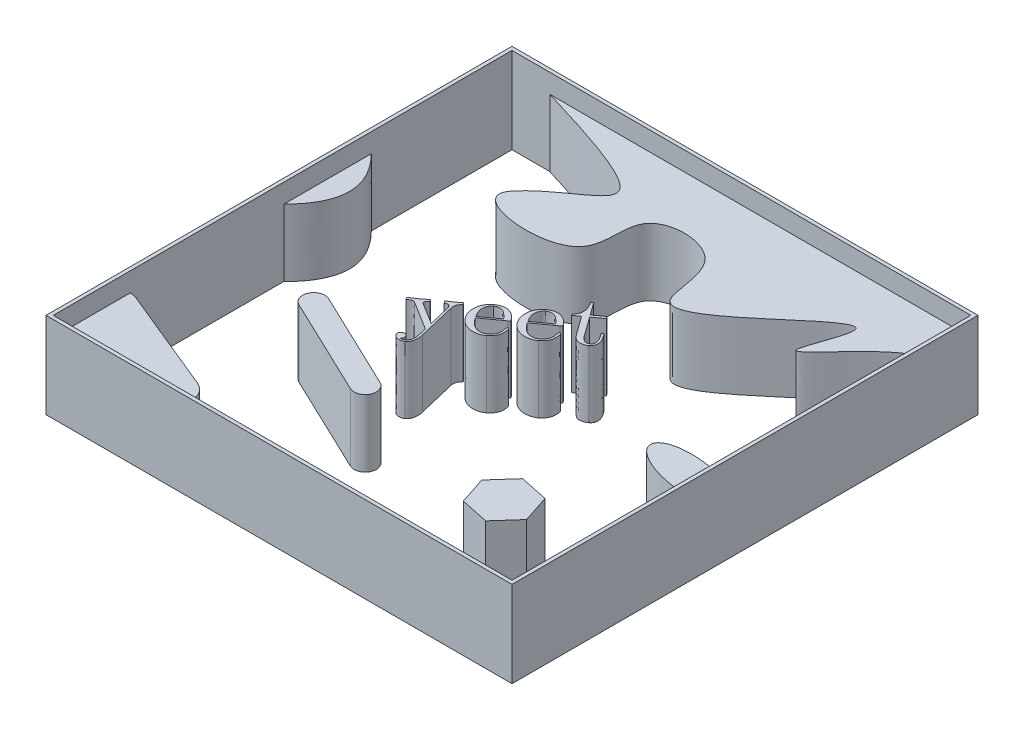
from build123d import *

# Parameters (mm, degrees)
SKETCH1_W                = 4953
SKETCH1_H                = 4953
SKETCH1_W_2              = 4876.8
SKETCH1_H_2              = 4876.8
BOSS_EXTRUDE1_DEPTH      = 914.4
BOSS_EXTRUDE2_DEPTH      = 711.2
BOSS_EXTRUDE2_DEPTH_BACK = 2.54
BOSS_EXTRUDE3_DEPTH      = 711.2
BOSS_EXTRUDE3_2_DEPTH    = 711.2
BOSS_EXTRUDE3_3_DEPTH    = 711.2
BOSS_EXTRUDE3_4_DEPTH    = 711.2
BOSS_EXTRUDE3_5_DEPTH    = 711.2


with BuildPart() as part:
    # Sketch1 → Boss-Extrude1 (new body)
    with BuildSketch(Plane(origin=(0, 0, 0), x_dir=(1, 0, 0), z_dir=(0, 1, 0))):
        Rectangle(SKETCH1_W, SKETCH1_H)
        Rectangle(SKETCH1_W_2, SKETCH1_H_2, mode=Mode.SUBTRACT)
    extrude(amount=BOSS_EXTRUDE1_DEPTH)

    # Sketch3 → Boss-Extrude2 (add, two sides: drawn at the far end of the back side and taken through both)
    with BuildSketch(Plane(origin=(0, 0, 0), x_dir=(1, 0, 0), z_dir=(0, 1, 0)).offset(-BOSS_EXTRUDE2_DEPTH_BACK)):
        with BuildLine():
            Line((-1331.522297366, -617.676058212), (-286.00507187, -1116.307350372))
            ThreePointArc((-286.00507187, -1116.307350372), (-230.167026806, -1273.967712905), (-387.82738934, -1329.805757969))
            Line((-387.82738934, -1329.805757969), (-1433.344614835, -831.17446581))
            ThreePointArc((-1433.344614835, -831.17446581), (-1489.182659899, -673.514103276), (-1331.522297366, -617.676058212))
        make_face()
        Polygon((1754.118220386, -1598.910920974), (1657.974140902, -1306.780680861), (1356.909892009, -1243.978776061), (1151.989722599, -1473.307111374), (1248.133802083, -1765.437351488), (1549.198050977, -1828.239256288), align=None)
        with BuildLine():
            Line((-2359.063833134, -1635.567425286), (-1252.1861305, -2091.344658835))
            ThreePointArc((-1252.1861305, -2091.344658835), (-1126.26137926, -2248.174931097), (-1191.585191407, -2438.4))
            Line((-1191.585191407, -2438.4), (-2438.4, -2438.4))
            Line((-2438.4, -2438.4), (-2438.4, -1619.872603883))
            ThreePointArc((-2438.4, -1619.872603883), (-2397.96315173, -1623.833964926), (-2359.063833134, -1635.567425286))
        make_face()
        with BuildLine():
            Line((-2438.4, 942.892603244), (-2438.4, 15.629799755))
            add(Edge.make_bspline(
                [(-2438.4, 942.892603244), (-1974.768598255, 479.2612015), (-2438.4, 15.629799755)],
                knots=[0, 0, 0, 1, 1, 1], degree=2))
        make_face()
        with BuildLine():
            Line((2438.4, 2438.4), (-2033.871111986, 2438.4))
            add(Edge.make_bspline(
                [(-2033.871111986, 2438.4), (-132.861045574, 1869.482226034), (-884.038824291, 1875.122459824), (-1598.144735508, 1067.86566456), (-185.869349394, 912.310001756), (-553.061712466, 1926.60510057), (493.217755425, 1908.913729189), (381.782702475, 899.461252853), (1122.889740167, 1447.820059883), (1961.417076987, 2223.653405623), (1328.255761502, 822.275024129), (2273.472620936, 2188.760131111), (2438.4, 1945.664883101)],
                knots=[0, 0, 0, 0, 0.232883367, 0.254080977, 0.374413592, 0.45076178, 0.536670962, 0.613758599, 0.711876288, 0.803327454, 0.869142534, 1, 1, 1, 1], degree=3))
            Line((2438.4, 1945.664883101), (2438.4, 2438.4))
        make_face()
    extrude(amount=BOSS_EXTRUDE2_DEPTH + BOSS_EXTRUDE2_DEPTH_BACK)


with BuildPart() as boss_extrude2_piece_1:
    # of the separate pieces the step leaves, piece 1, a body of its own (boss_extrude2_pieces)
    add(part.part.solids().sort_by_distance((-2476.5, 0, -2476.5))[0])


with BuildPart() as boss_extrude2_piece_2:
    # of the separate pieces the step leaves, piece 2, a body of its own (boss_extrude2_pieces)
    add(part.part.solids().sort_by_distance((-1433.344614835, 711.2, 831.17446581))[0])


with BuildPart() as boss_extrude2_piece_3:
    # of the separate pieces the step leaves, piece 3, a body of its own (boss_extrude2_pieces)
    add(part.part.solids().sort_by_distance((1754.118220386, 711.2, 1598.910920974))[0])


with BuildPart() as body_4:
    # Sketch5 → Boss-Extrude3 (new body)
    with BuildSketch(Plane(origin=(0, 0, 0), x_dir=(1, 0, 0), z_dir=(0, 1, 0))):
        with BuildLine():
            Line((2438.4, -191.102014594), (2438.4, -523.608637604))
            add(Edge.make_bspline(
                [(2438.4, -191.102014594), (1721.151111287, 69.064652132), (1721.151111287, -248.304260924), (1721.151111287, -565.67317398), (2438.4, -523.608637604)],
                knots=[1.141976661, 1.141976661, 1.141976661, 3.209045731, 3.209045731, 5.276114801, 5.276114801, 5.276114801], degree=2, weights=[1, 0.511785482, 1, 0.511785482, 1]))
        make_face()
    extrude(amount=BOSS_EXTRUDE3_DEPTH)


with BuildPart() as body_5:
    # Sketch5 → Boss-Extrude3 2 (new body)
    with BuildSketch(Plane(origin=(0, 0, 0), x_dir=(1, 0, 0), z_dir=(0, 1, 0))):
        with BuildLine():
            add(Edge.make_bspline(
                [(-640.160530282, -592.946270319), (-636.955082938, -596.760988355), (-630.699575198, -604.20550253), (-618.643704483, -612.437628467), (-605.257333451, -618.164979196), (-590.549498936, -620.691926764), (-575.362260503, -620.718373242), (-560.193430525, -617.973132453), (-545.316548657, -612.341590669), (-536.238153008, -606.591392069), (-531.558408985, -603.627271693)],
                knots=[0, 0, 0, 0, 0.98538293, 1.922998534, 2.867734393, 3.857062486, 4.864159226, 5.870279062, 6.902168487, 8, 8, 8, 8], degree=3))
            add(Edge.make_bspline(
                [(-531.558408985, -603.627271693), (-528.888465841, -601.446054188), (-523.627239335, -597.147880504), (-516.684507814, -589.873787656), (-510.565421828, -582.189928064), (-505.202145206, -574.099623383), (-501.006161877, -565.368240614), (-497.491901759, -556.279125085), (-494.716376313, -546.763774368), (-492.657315393, -533.384549762), (-491.213109892, -516.370075564), (-491.733381762, -495.745753613), (-493.755592028, -474.988523413), (-496.855820807, -461.344762206), (-498.422361531, -454.450591134)],
                knots=[0, 0, 0, 0, 0.765164453, 1.507786229, 2.227855625, 2.945389557, 3.658336933, 4.374536154, 5.108828506, 5.854267196, 7.377134679, 8.895207604, 10.431153287, 12, 12, 12, 12], degree=3))
            Line((-498.422361531, -454.450591134), (-593.736218663, -54.170215191))
            add(Edge.make_bspline(
                [(-593.736218663, -54.170215191), (-594.390379488, -50.634539472), (-595.649518705, -43.829014316), (-596.458542526, -33.841273127), (-596.860641962, -24.532644169), (-596.154134898, -15.859629196), (-594.876600589, -7.839305649), (-593.05171843, -0.415811551), (-590.137038683, 6.216670544), (-585.571090716, 13.859534482), (-579.495174201, 21.920513161), (-572.575945029, 30.059967877), (-566.35318714, 36.408445738), (-561.906699877, 39.256953398), (-559.923897077, 40.527176077)],
                knots=[0, 0, 0, 0, 1.202518849, 2.314627509, 3.35065016, 4.317034857, 5.220346734, 6.0681287, 6.867036849, 7.634240043, 9.043911647, 10.237408393, 11.214015161, 12, 12, 12, 12], degree=3))
            Line((-559.923897077, 40.527176077), (-576.042792181, 62.944700338))
            add(Edge.make_bspline(
                [(-576.042792181, 62.944700338), (-580.19720343, 59.452522093), (-588.775485747, 52.241658966), (-602.008472921, 41.662886812), (-615.466185178, 31.406825548), (-624.426125029, 24.78678957), (-628.774672719, 21.57387267)],
                knots=[0, 0, 0, 0, 0.971445824, 2.005900724, 3.032199329, 4, 4, 4, 4], degree=3))
            add(Edge.make_bspline(
                [(-628.774672719, 21.57387267), (-630.79388226, 20.154596397), (-635.163597134, 17.083180322), (-642.290888654, 12.108566377), (-650.687197935, 6.672457521), (-659.732700944, 0.51400668), (-668.998957683, -5.593010453), (-677.75940059, -11.340926489), (-685.614610276, -16.729292892), (-690.697133498, -19.956342328), (-693.112757074, -21.490095616)],
                knots=[0, 0, 0, 0, 0.765071328, 1.655669456, 2.693948275, 3.865243433, 5.047623292, 6.133935768, 7.11309628, 8, 8, 8, 8], degree=3))
            Line((-693.112757074, -21.490095616), (-676.949918631, -43.882563359))
            add(Edge.make_bspline(
                [(-676.949918631, -43.882563359), (-674.12603549, -42.26861135), (-668.748666113, -39.195249005), (-660.460945423, -36.067465606), (-652.625848156, -34.423374392), (-645.172951688, -34.320511307), (-638.230857116, -36.094738983), (-631.687018938, -39.273828358), (-625.686505691, -44.154622389), (-622.379149209, -48.323164736), (-620.651828402, -50.500253892)],
                knots=[0, 0, 0, 0, 1.224541911, 2.331829556, 3.323065307, 4.230252821, 5.114291739, 5.998182215, 6.954518048, 8, 8, 8, 8], degree=3))
            add(Edge.make_bspline(
                [(-620.651828402, -50.500253892), (-619.562938934, -52.013186259), (-617.584618811, -54.761917545), (-615.477294782, -59.37817133), (-613.787854846, -64.693474018), (-612.994686188, -68.667469017), (-612.528984085, -71.00076574)],
                knots=[0, 0, 0, 0, 1.001412343, 1.819389615, 2.719673511, 4, 4, 4, 4], degree=3))
            Line((-612.528984085, -71.00076574), (-557.186441126, -301.328453503))
            Line((-557.186441126, -301.328453503), (-777.585578496, -164.794107805))
            add(Edge.make_bspline(
                [(-777.585578496, -164.794107805), (-779.375180106, -163.837033683), (-782.55641107, -162.135719928), (-786.385584362, -159.206364312), (-789.533720408, -157.258560658), (-790.829590714, -155.611574141), (-791.360493103, -154.936823686)],
                knots=[0, 0, 0, 0, 1.425283331, 2.533611637, 3.399238425, 4, 4, 4, 4], degree=3))
            add(Edge.make_bspline(
                [(-791.360493103, -154.936823686), (-792.514654583, -152.628768945), (-794.717126348, -148.224337253), (-795.297497533, -140.813447692), (-793.007933718, -133.647123907), (-786.458337043, -125.247489787), (-776.936121909, -116.07898662), (-768.435641583, -109.898106923), (-764.413279415, -106.973362003)],
                knots=[0, 0, 0, 0, 0.753196916, 1.437316155, 2.124694232, 2.913400013, 4.539444533, 6, 6, 6, 6], degree=3))
            Line((-764.413279415, -106.973362003), (-780.541366106, -84.540854197))
            add(Edge.make_bspline(
                [(-780.541366106, -84.540854197), (-783.379859541, -86.724689681), (-789.4210439, -91.37256119), (-798.9353776, -98.947815543), (-809.852241263, -107.117849564), (-821.297251118, -116.066117249), (-832.485317504, -124.700603407), (-842.503091022, -132.203102756), (-850.691994895, -138.375669691), (-855.61021017, -142.003676102), (-857.761522047, -143.590628449)],
                knots=[0, 0, 0, 0, 0.884159283, 1.881762053, 3.002251819, 4.250180316, 5.468344128, 6.491188317, 7.340019842, 8, 8, 8, 8], degree=3))
            add(Edge.make_bspline(
                [(-857.761522047, -143.590628449), (-863.165306877, -147.432080172), (-874.641778162, -155.590493537), (-892.545398141, -167.806630398), (-910.983567134, -180.166857208), (-923.417435981, -188.095077764), (-929.448846498, -191.940892243)],
                knots=[0, 0, 0, 0, 0.91997491, 1.953827914, 3.007444586, 4, 4, 4, 4], degree=3))
            Line((-929.448846498, -191.940892243), (-913.243323838, -214.298734147))
            add(Edge.make_bspline(
                [(-913.243323838, -214.298734147), (-909.359901098, -211.344302326), (-902.059623403, -205.7903943), (-891.258164252, -198.885382504), (-881.663050822, -193.488069016), (-872.977512316, -189.5143598), (-864.220399517, -187.759093198), (-855.167327172, -188.704910637), (-845.690871377, -191.928250436), (-839.689693485, -195.551600576), (-836.487405977, -197.485055825)],
                knots=[0, 0, 0, 0, 1.363811471, 2.563769935, 3.580347654, 4.441850344, 5.224302887, 6.044594057, 6.95657617, 8, 8, 8, 8], degree=3))
            Line((-836.487405977, -197.485055825), (-537.860311857, -382.956919562))
            add(Edge.make_bspline(
                [(-537.860311857, -382.956919562), (-536.866730607, -386.97280214), (-534.591150486, -396.170301148), (-531.281588633, -410.641984483), (-528.020472435, -425.204151719), (-526.089645656, -434.59248955), (-525.240641182, -438.720638647)],
                knots=[0, 0, 0, 0, 0.868214978, 1.988456148, 3.115503395, 4, 4, 4, 4], degree=3))
            add(Edge.make_bspline(
                [(-525.240641182, -438.720638647), (-523.445932356, -445.363557333), (-519.868037834, -458.606743101), (-515.846215238, -478.839941558), (-513.209009638, -499.299793202), (-511.861200532, -516.40180755), (-511.898900964, -529.90755094), (-513.01442925, -539.619984773), (-515.399014621, -548.865975788), (-518.742714293, -557.661322658), (-523.146680518, -566.018453726), (-528.766386951, -573.761217994), (-535.395593119, -581.061358988), (-540.44881166, -585.413385165), (-543.033538258, -587.639451132)],
                knots=[0, 0, 0, 0, 1.548120252, 3.086300625, 4.63734821, 6.188365645, 6.942768019, 7.673299, 8.381664854, 9.085726505, 9.786592701, 10.500482471, 11.232995207, 12, 12, 12, 12], degree=3))
            add(Edge.make_bspline(
                [(-543.033538258, -587.639451132), (-543.663864327, -588.175886115), (-545.205908831, -589.488233261), (-548.393093221, -591.15426886), (-552.472849496, -593.381697873), (-557.534057447, -595.804981702), (-563.550055956, -598.103102217), (-570.538331284, -599.240036623), (-578.229679088, -599.829749538), (-583.561895611, -599.44505232), (-586.355374617, -599.243514442)],
                knots=[0, 0, 0, 0, 0.430926217, 1.054228022, 1.867099896, 2.860509904, 3.981717292, 5.213702243, 6.540294781, 8, 8, 8, 8], degree=3))
            add(Edge.make_bspline(
                [(-586.355374617, -599.243514442), (-584.170879678, -596.902403759), (-580.047701639, -592.483617528), (-575.426000473, -585.276045209), (-572.81868845, -578.07914792), (-572.154898392, -571.113738559), (-573.117766043, -564.677320882), (-574.393037591, -558.675962726), (-576.77128414, -553.271702098), (-578.954359683, -550.130907519), (-580.037606815, -548.572437986)],
                knots=[0, 0, 0, 0, 1.360769608, 2.568417653, 3.615270311, 4.588795655, 5.50971578, 6.374644527, 7.193494855, 8, 8, 8, 8], degree=3))
            add(Edge.make_bspline(
                [(-580.037606815, -548.572437986), (-581.80447288, -546.387886121), (-585.154458363, -542.245966607), (-591.321723966, -537.438412482), (-597.942215969, -534.1429345), (-605.000063272, -532.492076649), (-612.102892361, -532.20522494), (-619.11897104, -533.411158972), (-625.928576322, -536.048045625), (-630.104911606, -538.697972816), (-632.255891712, -540.062791559)],
                knots=[0, 0, 0, 0, 1.13470457, 2.151404632, 3.140004437, 4.106758316, 5.064697582, 6.000398941, 6.970125288, 8, 8, 8, 8], degree=3))
            add(Edge.make_bspline(
                [(-632.255891712, -540.062791559), (-634.088312663, -541.449993396), (-637.731387601, -544.207918776), (-641.942328735, -549.65823073), (-645.35293164, -555.681394435), (-647.886317917, -562.337734222), (-648.824479908, -569.679453183), (-647.795202089, -577.382565577), (-645.045927679, -585.397526395), (-641.909876574, -590.40432328), (-640.249801993, -593.054680677)],
                knots=[0, 0, 0, 0, 0.914342427, 1.817823563, 2.724885434, 3.675259209, 4.644058747, 5.646935001, 6.754400595, 8, 8, 8, 8], degree=3))
            Line((-640.249801993, -593.054680677), (-640.160530282, -592.946270319))
        make_face()
    extrude(amount=BOSS_EXTRUDE3_2_DEPTH)


with BuildPart() as body_6:
    # Sketch5 → Boss-Extrude3 3 (new body)
    with BuildSketch(Plane(origin=(0, 0, 0), x_dir=(1, 0, 0), z_dir=(0, 1, 0))):
        with BuildLine():
            add(Edge.make_bspline(
                [(-430.197437868, -66.284520734), (-425.55038794, -72.08848683), (-416.437335217, -83.470298916), (-401.419540439, -98.859328058), (-385.612018485, -112.352941822), (-369.098730994, -123.999692983), (-351.845988061, -133.777595357), (-333.796737978, -141.530867991), (-315.009071293, -147.480151601), (-295.661285268, -151.600882323), (-276.178968963, -153.686523091), (-256.935279829, -154.331934782), (-238.098398579, -152.881727877), (-219.724288284, -149.614438052), (-201.74869338, -144.760016135), (-184.345474047, -137.773897892), (-167.13561061, -129.349503394), (-156.359343652, -122.255814126), (-150.886022309, -118.652892909)],
                knots=[0, 0, 0, 0, 1.131068036, 2.218070132, 3.26666733, 4.290156654, 5.288892247, 6.279174308, 7.274197475, 8.283818965, 9.284245246, 10.25266225, 11.210350448, 12.153453024, 13.089703203, 14.038346771, 15.003666248, 16, 16, 16, 16], degree=3))
            add(Edge.make_bspline(
                [(-150.886022309, -118.652892909), (-145.953239194, -114.393981261), (-136.393164025, -106.139915645), (-123.751098405, -92.806349149), (-112.96709959, -79.34728979), (-103.97662214, -65.800925024), (-96.898161532, -52.027633257), (-91.829627209, -38.033098496), (-88.668191585, -23.811512261), (-87.539689658, -9.682633368), (-87.492701131, 3.794931019), (-87.905136348, 16.132542587), (-88.502608631, 27.147062911), (-89.456136934, 36.803859553), (-90.979515004, 45.13452288), (-92.956185262, 52.081305483), (-94.923007159, 57.931796848), (-97.056088034, 60.985963982), (-98.023067227, 62.370494735)],
                knots=[0, 0, 0, 0, 1.535400916, 2.97571327, 4.323711317, 5.596561669, 6.801736929, 7.96500917, 9.09571083, 10.224777478, 11.29868402, 12.27171011, 13.134311792, 13.898427741, 14.558093932, 15.125867625, 15.603733816, 16, 16, 16, 16], degree=3))
            add(Edge.make_bspline(
                [(-98.023067227, 62.370494735), (-99.270521176, 63.819669386), (-101.492417665, 66.400859713), (-106.351761958, 67.320741236), (-110.369947139, 66.354894017), (-112.577451813, 64.963975145), (-113.624085678, 64.304505287)],
                knots=[0, 0, 0, 0, 1.257649699, 2.2400566, 3.165566269, 4, 4, 4, 4], degree=3))
            add(Edge.make_bspline(
                [(-113.624085678, 64.304505287), (-114.759381594, 63.175396311), (-116.936376791, 61.010264927), (-118.466054069, 56.585299608), (-117.956874277, 51.827399553), (-116.48438635, 48.964444277), (-115.687030267, 47.414146468)],
                knots=[0, 0, 0, 0, 1.016211831, 1.948644617, 2.889185667, 4, 4, 4, 4], degree=3))
            add(Edge.make_bspline(
                [(-115.687030267, 47.414146468), (-114.448435527, 41.79849943), (-112.06917139, 31.01118767), (-109.882557413, 15.197135348), (-108.848799156, 0.447644069), (-109.435507803, -13.272381157), (-110.951764673, -26.027015785), (-114.154329359, -37.670728038), (-118.256626774, -48.431174671), (-124.138216636, -57.714441413), (-130.117688624, -65.987257888), (-135.692707029, -73.438535922), (-140.865249674, -79.841395314), (-145.40480067, -85.39073614), (-149.597953216, -89.861205029), (-153.290319863, -93.30729676), (-156.486045907, -95.945428664), (-158.686841439, -96.941329317), (-159.65353681, -97.378776839)],
                knots=[0, 0, 0, 0, 1.70156369, 3.268598948, 4.721597164, 6.071050592, 7.328692465, 8.513650065, 9.638130624, 10.722459064, 11.753225822, 12.661554351, 13.476136649, 14.189569928, 14.783549195, 15.287621533, 15.687089075, 16, 16, 16, 16], degree=3))
            add(Edge.make_bspline(
                [(-159.65353681, -97.378776839), (-164.211936249, -100.368236502), (-173.158825576, -106.235726859), (-187.790358571, -112.290386846), (-202.643014087, -116.648362214), (-217.889071852, -118.314187178), (-233.020858688, -118.135829332), (-247.897084218, -116.47808161), (-262.368173275, -113.178942172), (-271.60254237, -109.691419948), (-276.209906062, -107.951367856)],
                knots=[0, 0, 0, 0, 1.068251518, 2.096685083, 3.096031983, 4.098936556, 5.094891896, 6.063287244, 7.033703338, 8, 8, 8, 8], degree=3))
            add(Edge.make_bspline(
                [(-276.209906062, -107.951367856), (-281.913604237, -105.202986124), (-293.272583691, -99.729552808), (-308.89644302, -89.246830403), (-323.607154562, -77.640625553), (-336.506308709, -64.380909628), (-348.255337412, -51.072524676), (-358.731408352, -38.306716388), (-368.077347487, -26.619554116), (-373.466300538, -18.80162041), (-376.004850532, -15.118861372)],
                knots=[0, 0, 0, 0, 1.099442206, 2.189551594, 3.263146346, 4.35156425, 5.399633039, 6.34964989, 7.222576961, 8, 8, 8, 8], degree=3))
            Line((-376.004850532, -15.118861372), (-174.345343659, 130.320620802))
            add(Edge.make_bspline(
                [(-174.345343659, 130.320620802), (-172.560614809, 131.533090409), (-169.33654788, 133.723385679), (-165.309012717, 137.122897306), (-162.364175314, 139.963118244), (-160.59574723, 142.849576548), (-160.39386771, 146.071720933), (-161.461702174, 149.730730227), (-163.915078924, 153.909455648), (-166.06851747, 156.81684377), (-167.26064498, 158.426352139)],
                knots=[0, 0, 0, 0, 1.436110452, 2.594296726, 3.505381516, 4.158772196, 4.791131605, 5.589574521, 6.665606441, 8, 8, 8, 8], degree=3))
            add(Edge.make_bspline(
                [(-167.26064498, 158.426352139), (-170.637840181, 162.944282246), (-177.315340942, 171.877281358), (-188.256402746, 184.259738117), (-199.977108683, 195.432497732), (-212.281317547, 205.475744607), (-225.334290962, 214.317740834), (-239.012830589, 222.107491005), (-253.458809444, 228.619864777), (-268.40440373, 234.099976968), (-283.830267429, 238.119519844), (-299.680749546, 239.698463458), (-315.740640283, 239.465403034), (-332.049033486, 237.147801967), (-348.514182369, 232.471697127), (-365.232633455, 225.984521615), (-382.207151613, 217.43737354), (-393.17116777, 210.40418539), (-398.826175043, 206.776615933)],
                knots=[0, 0, 0, 0, 1.015912272, 2.008694957, 2.972523722, 3.930237631, 4.866555191, 5.809635098, 6.762485493, 7.717692293, 8.675406202, 9.625358091, 10.57783092, 11.563310402, 12.583286221, 13.654490728, 14.790236005, 16, 16, 16, 16], degree=3))
            add(Edge.make_bspline(
                [(-398.826175043, 206.776615933), (-403.902810037, 202.710720781), (-413.870054968, 194.727918612), (-427.054037138, 181.158071659), (-438.620696649, 166.80633462), (-448.478426456, 151.507209143), (-456.63457111, 135.297797132), (-463.140247159, 118.204206074), (-467.75359379, 100.157704423), (-470.65057129, 81.418277445), (-472.024215089, 62.343989015), (-471.291172925, 43.307998618), (-469.006268614, 24.482234929), (-464.842650706, 5.832774993), (-458.855890475, -12.606801361), (-451.256904811, -30.910024954), (-441.628868786, -48.875833722), (-434.111281796, -60.427696584), (-430.286080018, -66.305673975)],
                knots=[0, 0, 0, 0, 1.022674735, 2.007875213, 2.97010464, 3.919364326, 4.866066721, 5.820707959, 6.791809536, 7.791413452, 8.801396519, 9.796161153, 10.784351695, 11.78200896, 12.797952547, 13.831682103, 14.896686731, 16, 16, 16, 16], degree=3))
            Line((-430.286080018, -66.305673975), (-430.197437868, -66.284520734))
        make_face()
        with BuildLine():
            add(Edge.make_bspline(
                [(-386.175026332, 0.615623953), (-390.124776235, 7.275717717), (-397.712659243, 20.070454993), (-407.394630669, 39.131648387), (-415.104890513, 57.126378033), (-420.800371746, 73.983858674), (-424.715011167, 89.707714063), (-426.473654545, 104.353850364), (-426.165479218, 117.964970279), (-423.774025857, 130.375588871), (-420.086646896, 141.561138141), (-416.498371214, 151.818165546), (-412.432509492, 160.991911417), (-408.123131165, 169.084108403), (-403.409967305, 176.160042546), (-398.497764251, 182.228135197), (-393.093642008, 187.116922721), (-389.231813627, 189.672920483), (-387.351045769, 190.917729408)],
                knots=[0, 0, 0, 0, 1.764794658, 3.390355271, 4.86978527, 6.22369754, 7.442747435, 8.557148513, 9.576495169, 10.533429504, 11.425901639, 12.25959669, 13.009652899, 13.711035334, 14.346881608, 14.94524135, 15.48631685, 16, 16, 16, 16], degree=3))
            add(Edge.make_bspline(
                [(-387.351045769, 190.917729408), (-382.639221669, 193.488811456), (-373.543041502, 198.452287392), (-359.407066106, 203.680169449), (-345.496051134, 206.566729692), (-331.88420392, 207.419079255), (-318.505705309, 205.967741338), (-305.479698915, 202.311645143), (-292.780477804, 196.349086073), (-280.703219615, 188.365902037), (-269.397073162, 179.397516191), (-258.551196248, 170.838304349), (-248.962442061, 162.259166338), (-240.132632359, 154.198757944), (-232.368409922, 146.336948314), (-225.657498137, 138.682830318), (-219.769394019, 131.403661469), (-216.517861005, 126.392348691), (-214.96623859, 124.000964318)],
                knots=[0, 0, 0, 0, 1.248451728, 2.410137052, 3.493293662, 4.545557497, 5.572009155, 6.611013558, 7.680872553, 8.824274789, 9.972961583, 11.040197452, 12.039770359, 12.967240324, 13.823316975, 14.61017667, 15.336780213, 16, 16, 16, 16], degree=3))
            Line((-214.96623859, 124.000964318), (-386.175026332, 0.615623953))
        make_face(mode=Mode.SUBTRACT)
    extrude(amount=BOSS_EXTRUDE3_3_DEPTH)


with BuildPart() as body_7:
    # Sketch5 → Boss-Extrude3 4 (new body)
    with BuildSketch(Plane(origin=(0, 0, 0), x_dir=(1, 0, 0), z_dir=(0, 1, 0))):
        with BuildLine():
            add(Edge.make_bspline(
                [(-107.894001014, 163.941689306), (-103.246951086, 158.13772321), (-94.133898362, 146.755911124), (-79.116103585, 131.366881982), (-63.308581631, 117.873268218), (-46.79529414, 106.226517057), (-29.542551207, 96.448614683), (-11.493301124, 88.695342049), (7.294365561, 82.746058439), (26.642151587, 78.625327717), (46.124467891, 76.539686949), (65.368157025, 75.894275258), (84.205038276, 77.344482163), (102.579148571, 80.611771988), (120.554743475, 85.466193905), (137.957962808, 92.452312148), (155.167826245, 100.876706646), (165.944093203, 107.970395914), (171.417414546, 111.573317131)],
                knots=[0, 0, 0, 0, 1.131068036, 2.218070132, 3.26666733, 4.290156654, 5.288892247, 6.279174308, 7.274197475, 8.283818965, 9.284245246, 10.25266225, 11.210350448, 12.153453024, 13.089703203, 14.038346771, 15.003666248, 16, 16, 16, 16], degree=3))
            add(Edge.make_bspline(
                [(171.417414546, 111.573317131), (176.35019766, 115.832228779), (185.910272829, 124.086294395), (198.552338449, 137.419860891), (209.336337265, 150.87892025), (218.326814714, 164.425285016), (225.405275323, 178.198576783), (230.473809645, 192.193111544), (233.63524527, 206.414697779), (234.763747197, 220.543576672), (234.810735723, 234.021141059), (234.398300507, 246.358752627), (233.800828223, 257.373272951), (232.84729992, 267.030069593), (231.323921851, 275.36073292), (229.347251592, 282.307515523), (227.380429695, 288.158006888), (225.24734882, 291.212174022), (224.280369627, 292.596704775)],
                knots=[0, 0, 0, 0, 1.535400916, 2.97571327, 4.323711317, 5.596561669, 6.801736929, 7.96500917, 9.09571083, 10.224777478, 11.29868402, 12.27171011, 13.134311792, 13.898427741, 14.558093932, 15.125867625, 15.603733816, 16, 16, 16, 16], degree=3))
            add(Edge.make_bspline(
                [(224.280369627, 292.596704775), (223.032915678, 294.045879426), (220.81101919, 296.627069753), (215.951674896, 297.546951276), (211.933489715, 296.581104057), (209.725985041, 295.190185185), (208.679351176, 294.530715327)],
                knots=[0, 0, 0, 0, 1.257649699, 2.2400566, 3.165566269, 4, 4, 4, 4], degree=3))
            add(Edge.make_bspline(
                [(208.679351176, 294.530715327), (207.544055261, 293.401606351), (205.367060064, 291.236474968), (203.837382785, 286.811509648), (204.346562577, 282.053609593), (205.819050504, 279.190654317), (206.616406588, 277.640356508)],
                knots=[0, 0, 0, 0, 1.016211831, 1.948644617, 2.889185667, 4, 4, 4, 4], degree=3))
            add(Edge.make_bspline(
                [(206.616406588, 277.640356508), (207.855001328, 272.02470947), (210.234265465, 261.23739771), (212.420879442, 245.423345388), (213.454637699, 230.673854109), (212.867929051, 216.953828883), (211.351672181, 204.199194255), (208.149107495, 192.555482002), (204.04681008, 181.795035369), (198.165220219, 172.511768627), (192.18574823, 164.238952152), (186.610729825, 156.787674118), (181.438187181, 150.384814726), (176.898636185, 144.8354739), (172.705483639, 140.365005011), (169.013116991, 136.91891328), (165.817390947, 134.280781376), (163.616595415, 133.284880723), (162.649900045, 132.847433201)],
                knots=[0, 0, 0, 0, 1.70156369, 3.268598948, 4.721597164, 6.071050592, 7.328692465, 8.513650065, 9.638130624, 10.722459064, 11.753225822, 12.661554351, 13.476136649, 14.189569928, 14.783549195, 15.287621533, 15.687089075, 16, 16, 16, 16], degree=3))
            add(Edge.make_bspline(
                [(162.649900045, 132.847433201), (158.091500606, 129.857973538), (149.144611279, 123.990483181), (134.513078283, 117.935823194), (119.660422767, 113.577847826), (104.414365002, 111.912022862), (89.282578166, 112.090380708), (74.406352636, 113.74812843), (59.93526358, 117.047267868), (50.700894484, 120.534790092), (46.093530792, 122.274842184)],
                knots=[0, 0, 0, 0, 1.068251518, 2.096685083, 3.096031983, 4.098936556, 5.094891896, 6.063287244, 7.033703338, 8, 8, 8, 8], degree=3))
            add(Edge.make_bspline(
                [(46.093530792, 122.274842184), (40.389832617, 125.023223916), (29.030853163, 130.496657232), (13.406993834, 140.979379637), (-1.303717707, 152.585584487), (-14.202871855, 165.845300412), (-25.951900558, 179.153685364), (-36.427971497, 191.919493652), (-45.773910633, 203.606655924), (-51.162863684, 211.42458963), (-53.701413678, 215.107348669)],
                knots=[0, 0, 0, 0, 1.099442206, 2.189551594, 3.263146346, 4.35156425, 5.399633039, 6.34964989, 7.222576961, 8, 8, 8, 8], degree=3))
            Line((-53.701413678, 215.107348669), (147.958093195, 360.546830842))
            add(Edge.make_bspline(
                [(147.958093195, 360.546830842), (149.742822046, 361.759300449), (152.966888974, 363.949595719), (156.994424137, 367.349107346), (159.93926154, 370.189328284), (161.707689624, 373.075786588), (161.909569144, 376.297930973), (160.841734681, 379.956940267), (158.38835793, 384.135665688), (156.234919384, 387.04305381), (155.042791874, 388.652562179)],
                knots=[0, 0, 0, 0, 1.436110452, 2.594296726, 3.505381516, 4.158772196, 4.791131605, 5.589574521, 6.665606441, 8, 8, 8, 8], degree=3))
            add(Edge.make_bspline(
                [(155.042791874, 388.652562179), (151.665596673, 393.170492286), (144.988095912, 402.103491398), (134.047034108, 414.485948157), (122.326328172, 425.658707772), (110.022119307, 435.701954647), (96.969145892, 444.543950874), (83.290606265, 452.333701045), (68.84462741, 458.846074817), (53.899033124, 464.326187008), (38.473169425, 468.345729884), (22.622687308, 469.924673498), (6.562796571, 469.691613074), (-9.745596632, 467.374012007), (-26.210745514, 462.697907167), (-42.9291966, 456.210731655), (-59.903714758, 447.66358358), (-70.867730916, 440.63039543), (-76.522738189, 437.002825973)],
                knots=[0, 0, 0, 0, 1.015912272, 2.008694957, 2.972523722, 3.930237631, 4.866555191, 5.809635098, 6.762485493, 7.717692293, 8.675406202, 9.625358091, 10.57783092, 11.563310402, 12.583286221, 13.654490728, 14.790236005, 16, 16, 16, 16], degree=3))
            add(Edge.make_bspline(
                [(-76.522738189, 437.002825973), (-81.599373182, 432.936930821), (-91.566618113, 424.954128652), (-104.750600284, 411.384281699), (-116.317259794, 397.03254466), (-126.174989601, 381.733419183), (-134.331134255, 365.524007172), (-140.836810305, 348.430416114), (-145.450156936, 330.383914463), (-148.347134436, 311.644487485), (-149.720778235, 292.570199056), (-148.987736071, 273.534208658), (-146.702831759, 254.708444969), (-142.539213852, 236.058985033), (-136.55245362, 217.619408679), (-128.953467957, 199.316185086), (-119.325431932, 181.350376318), (-111.807844942, 169.798513456), (-107.982643164, 163.920536065)],
                knots=[0, 0, 0, 0, 1.022674735, 2.007875213, 2.97010464, 3.919364326, 4.866066721, 5.820707959, 6.791809536, 7.791413452, 8.801396519, 9.796161153, 10.784351695, 11.78200896, 12.797952547, 13.831682103, 14.896686731, 16, 16, 16, 16], degree=3))
            Line((-107.982643164, 163.920536065), (-107.894001014, 163.941689306))
        make_face()
        with BuildLine():
            add(Edge.make_bspline(
                [(-63.871589478, 230.841833993), (-67.82133938, 237.501927757), (-75.409222389, 250.296665033), (-85.091193814, 269.357858427), (-92.801453659, 287.352588073), (-98.496934891, 304.210068714), (-102.411574313, 319.933924103), (-104.170217691, 334.580060404), (-103.862042363, 348.191180319), (-101.470589002, 360.601798911), (-97.783210042, 371.787348181), (-94.19493436, 382.044375586), (-90.129072637, 391.218121457), (-85.81969431, 399.310318443), (-81.106530451, 406.386252586), (-76.194327397, 412.454345237), (-70.790205153, 417.343132761), (-66.928376773, 419.899130523), (-65.047608915, 421.143939448)],
                knots=[0, 0, 0, 0, 1.764794658, 3.390355271, 4.86978527, 6.22369754, 7.442747435, 8.557148513, 9.576495169, 10.533429504, 11.425901639, 12.25959669, 13.009652899, 13.711035334, 14.346881608, 14.94524135, 15.48631685, 16, 16, 16, 16], degree=3))
            add(Edge.make_bspline(
                [(-65.047608915, 421.143939448), (-60.335784815, 423.715021497), (-51.239604648, 428.678497432), (-37.103629251, 433.906379489), (-23.192614279, 436.792939732), (-9.580767065, 437.645289295), (3.797731545, 436.193951378), (16.823737939, 432.537855183), (29.52295905, 426.575296113), (41.600217239, 418.592112077), (52.906363692, 409.623726231), (63.752240606, 401.064514389), (73.340994794, 392.485376378), (82.170804495, 384.424967984), (89.935026933, 376.563158354), (96.645938718, 368.909040358), (102.534042836, 361.629871509), (105.785575849, 356.618558731), (107.337198264, 354.227174358)],
                knots=[0, 0, 0, 0, 1.248451728, 2.410137052, 3.493293662, 4.545557497, 5.572009155, 6.611013558, 7.680872553, 8.824274789, 9.972961583, 11.040197452, 12.039770359, 12.967240324, 13.823316975, 14.61017667, 15.336780213, 16, 16, 16, 16], degree=3))
            Line((107.337198264, 354.227174358), (-63.871589478, 230.841833993))
        make_face(mode=Mode.SUBTRACT)
    extrude(amount=BOSS_EXTRUDE3_4_DEPTH)


with BuildPart() as body_8:
    # Sketch5 → Boss-Extrude3 5 (new body)
    with BuildSketch(Plane(origin=(0, 0, 0), x_dir=(1, 0, 0), z_dir=(0, 1, 0))):
        with BuildLine():
            Line((114.098881135, 519.547310356), (175.520714293, 563.845091753))
            Line((175.520714293, 563.845091753), (319.358216242, 364.404786441))
            add(Edge.make_bspline(
                [(319.358216242, 364.404786441), (323.362339081, 359.4926034), (331.037066936, 350.077390748), (343.525799643, 337.907859034), (355.595703955, 327.484748978), (367.782307269, 319.49706613), (379.73378198, 313.334405421), (391.716276949, 309.529678712), (403.641662267, 307.892606667), (418.790719796, 308.81602392), (436.113488808, 312.334192843), (454.735131794, 317.632123502), (470.457164999, 324.590334086), (478.905258588, 331.027123441), (482.89039231, 334.063484964)],
                knots=[0, 0, 0, 0, 1.20634848, 2.312215848, 3.317609615, 4.239625383, 5.081837635, 5.871673608, 6.62323364, 7.36088261, 8.751640812, 9.982161073, 11.048145256, 12, 12, 12, 12], degree=3))
            add(Edge.make_bspline(
                [(482.89039231, 334.063484964), (485.782661061, 336.49547611), (491.447260132, 341.258607056), (498.771435771, 349.222302646), (504.774328024, 357.60708453), (509.688277615, 366.271131239), (512.999794984, 375.489323707), (515.068302669, 385.06997564), (516.043419188, 394.994008209), (515.15774445, 408.715116924), (511.907700336, 425.789680706), (505.655899814, 445.905416901), (496.222626263, 465.140201009), (488.151921793, 477.056149913), (484.050798641, 483.111231486)],
                knots=[0, 0, 0, 0, 0.815415642, 1.597017112, 2.328469583, 3.03877491, 3.740479769, 4.434036477, 5.151580157, 5.885677184, 7.394746977, 8.894542429, 10.421963784, 12, 12, 12, 12], degree=3))
            Line((484.050798641, 483.111231486), (454.407680011, 524.415829366))
            Line((454.407680011, 524.415829366), (436.342434964, 511.387070131))
            Line((436.342434964, 511.387070131), (465.00570528, 471.643531029))
            add(Edge.make_bspline(
                [(465.00570528, 471.643531029), (469.322940717, 465.203132751), (477.454464196, 453.072626882), (486.507235897, 434.547850354), (492.564075287, 417.385897307), (494.788141272, 401.43973957), (494.215253952, 387.050609294), (490.543413247, 374.473969654), (484.288627482, 363.576343186), (478.043789946, 358.355588231), (474.89648203, 355.724403144)],
                knots=[0, 0, 0, 0, 1.44305374, 2.71799524, 3.83219361, 4.818576593, 5.70073713, 6.493826648, 7.240910386, 8, 8, 8, 8], degree=3))
            add(Edge.make_bspline(
                [(474.89648203, 355.724403144), (471.84436973, 354.079910042), (465.986534859, 350.923679834), (456.818814407, 347.907326311), (448.004597025, 345.868643223), (439.357710004, 345.876981114), (430.955921563, 346.927684164), (422.848677101, 349.800320767), (414.930314374, 353.892738005), (405.362041533, 361.298425506), (395.022476102, 370.907644658), (384.029242936, 381.198228543), (375.820977068, 390.273320323), (371.906253101, 396.295605403), (370.202044162, 398.917305467)],
                knots=[0, 0, 0, 0, 0.981442391, 1.883655285, 2.730104348, 3.534873072, 4.322842825, 5.120934394, 5.960772194, 6.841052878, 8.542053661, 9.964769048, 11.11399659, 12, 12, 12, 12], degree=3))
            Line((370.202044162, 398.917305467), (225.380790621, 599.80446724))
            Line((225.380790621, 599.80446724), (328.713992286, 674.328970062))
            Line((328.713992286, 674.328970062), (312.558330836, 696.729873919))
            Line((312.558330836, 696.729873919), (209.22512917, 622.205371098))
            Line((209.22512917, 622.205371098), (113.333461204, 755.165574639))
            Line((113.333461204, 755.165574639), (95.268216158, 742.136815405))
            add(Edge.make_bspline(
                [(95.268216158, 742.136815405), (100.660638075, 734.122580218), (111.400401287, 718.161108816), (124.351626929, 692.309899686), (134.141730626, 665.02130104), (139.89942594, 641.494423161), (142.600520044, 622.423240972), (142.409909904, 608.409840034), (140.539203939, 594.850065191), (136.581287466, 581.845543284), (130.853475195, 569.355883239), (123.239001267, 557.374687565), (113.806507307, 545.846164327), (106.360534822, 538.898862912), (102.534983799, 535.329516383)],
                knots=[0, 0, 0, 0, 1.515487936, 3.0183064, 4.5252851, 6.058829905, 6.813768158, 7.542560294, 8.251591763, 8.956081312, 9.66866797, 10.402534302, 11.17926281, 12, 12, 12, 12], degree=3))
            Line((102.534983799, 535.329516383), (114.098881135, 519.547310356))
        make_face()
    extrude(amount=BOSS_EXTRUDE3_5_DEPTH)


solid = Compound([boss_extrude2_piece_1.part, boss_extrude2_piece_2.part, boss_extrude2_piece_3.part, body_4.part, body_5.part, body_6.part, body_7.part, body_8.part])
